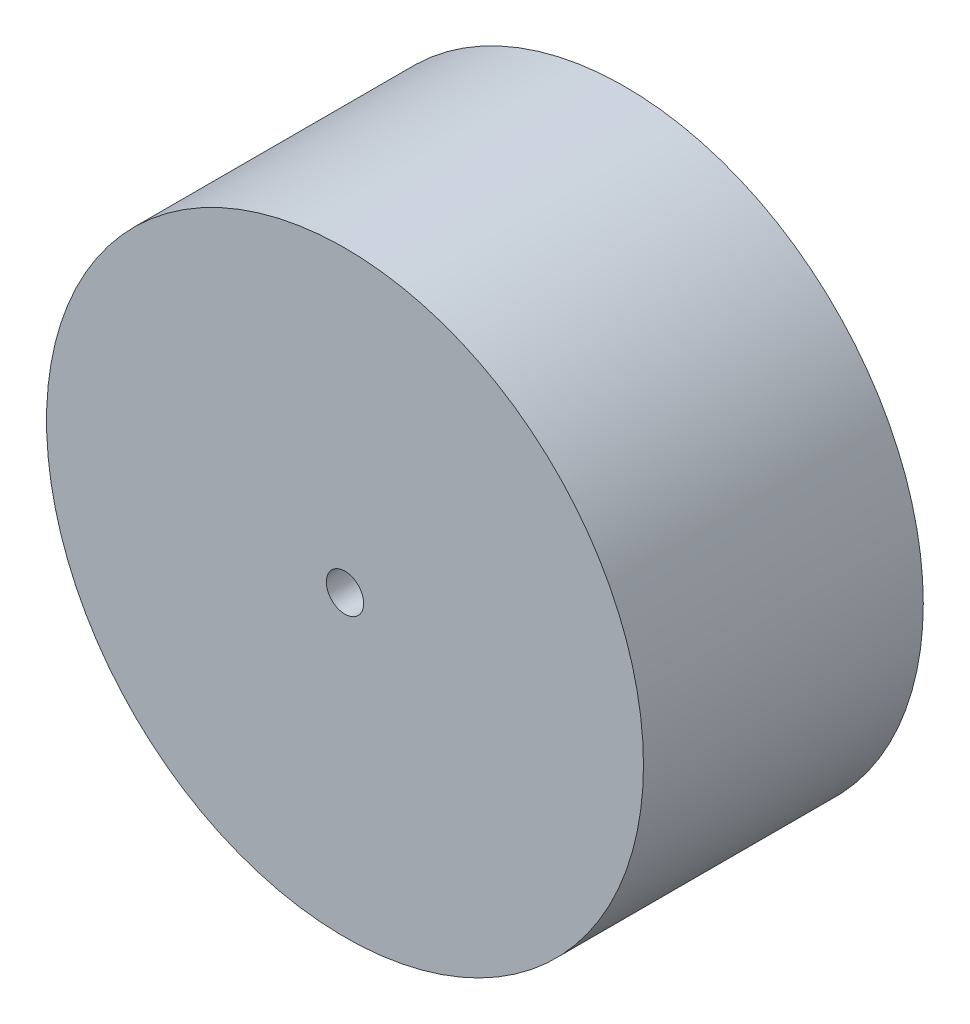
from build123d import *

# Parameters (mm, degrees)
SKETCH1_R           = 40
BOSS_EXTRUDE1_DEPTH = 37.5
SKETCH2_R           = 2.5
CUT_EXTRUDE1_DEPTH  = 68.869359802


with BuildPart() as part:
    # Sketch1 → Boss-Extrude1 (new body)
    with BuildSketch(Plane.XY):
        Circle(SKETCH1_R)
    extrude(amount=-BOSS_EXTRUDE1_DEPTH)

    # Sketch2 → Cut-Extrude1 (cut, through all)
    with BuildSketch(Plane.XY):
        Circle(SKETCH2_R)
    extrude(amount=-CUT_EXTRUDE1_DEPTH, mode=Mode.SUBTRACT)


solid = part.part
